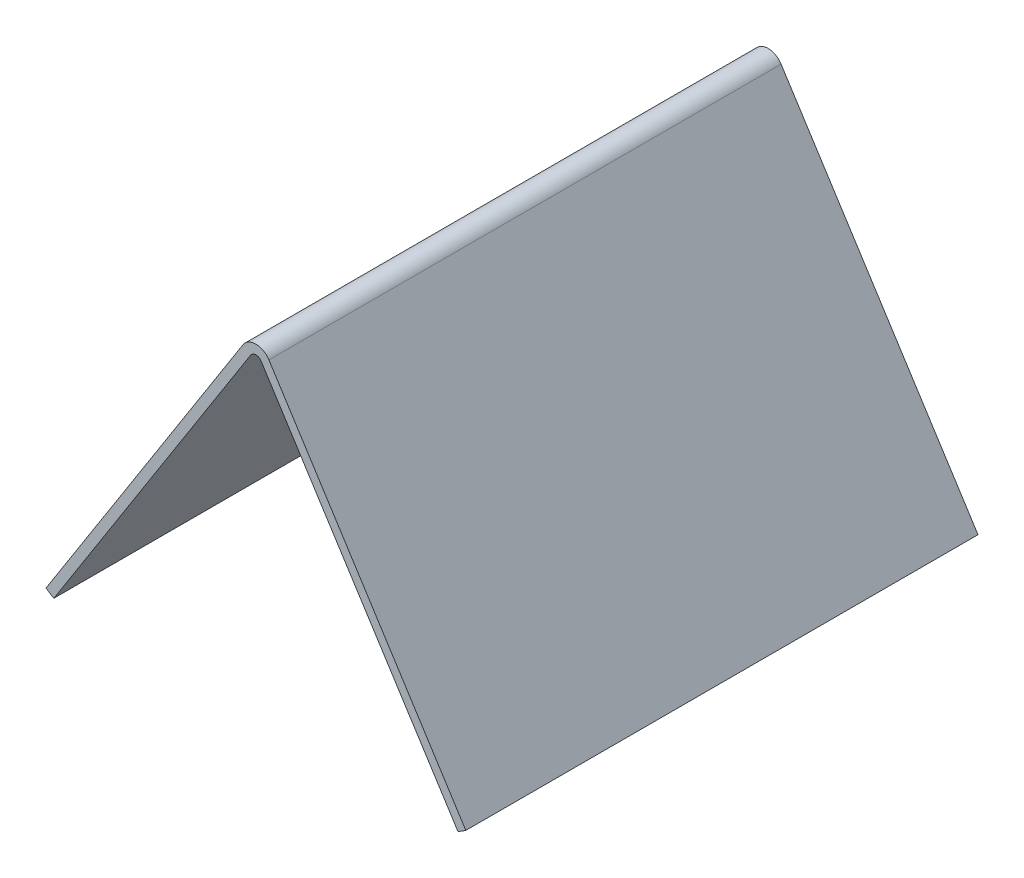
from build123d import *

# Parameters (mm, degrees)
BOSS_EXTRUDE1_DEPTH = 166


with BuildPart() as part:
    # Sketch1 → Boss-Extrude1 (new body)
    with BuildSketch(Plane.XY):
        with BuildLine():
            ThreePointArc((-4.216957229, 111.186498042), (0, 113.5), (4.216957229, 111.186498042))
            Line((4.216957229, 111.186498042), (68.030174337, 11.019811517))
            Line((68.030174337, 11.019811517), (65.5, 9.407912692))
            Line((65.5, 9.407912692), (1.686782892, 109.574599217))
            ThreePointArc((1.686782892, 109.574599217), (0, 110.5), (-1.686782892, 109.574599217))
            Line((-1.686782892, 109.574599217), (-65.5, 9.407912692))
            Line((-65.5, 9.407912692), (-68.030174337, 11.019811517))
            Line((-68.030174337, 11.019811517), (-4.216957229, 111.186498042))
        make_face()
    extrude(amount=BOSS_EXTRUDE1_DEPTH)


solid = part.part
